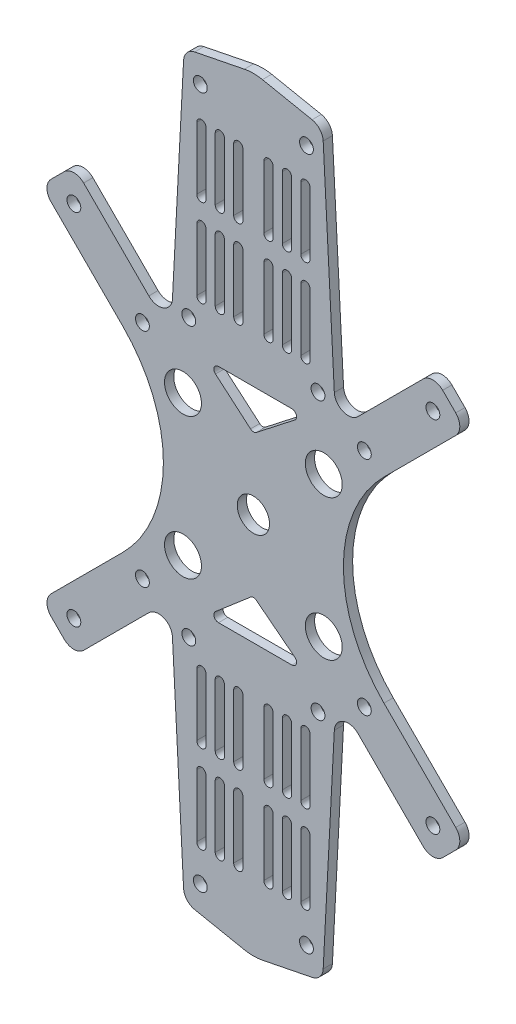
from build123d import *

# Parameters (mm, degrees)
CROQUIS1_R              = 4
CROQUIS1_R_2            = 1.5
CROQUIS1_R_3            = 3.5
SALIENTE_EXTRUIR1_DEPTH = 2
REDONDEO1_R             = 3
REDONDEO2_R             = 10


with BuildPart() as part:
    # Croquis1 → Saliente-Extruir1 (new body)
    with BuildSketch(Plane.XY):
        with BuildLine():
            Line((-42.426406871, 42.426406871), (-38.890872965, 45.961940777))
            Line((-38.890872965, 45.961940777), (-31.096194078, 38.16726189))
            Line((-31.096194078, 38.16726189), (-22.653119822, 29.724187634))
            ThreePointArc((-22.653119822, 29.724187634), (-19.456811617, 29.044722177), (-17.535923889, 31.688251973))
            Line((-17.535923889, 31.688251973), (-15, 80))
            Line((-15, 80), (0, 83))
            Line((0, 83), (15, 80))
            Line((15, 80), (17.535923889, 31.688251973))
            ThreePointArc((17.535923889, 31.688251973), (19.456811617, 29.044722177), (22.653119822, 29.724187634))
            Line((22.653119822, 29.724187634), (31.096194078, 38.16726189))
            Line((31.096194078, 38.16726189), (38.890872965, 45.961940777))
            Line((38.890872965, 45.961940777), (42.426406871, 42.426406871))
            Line((42.426406871, 42.426406871), (45.961940777, 38.890872965))
            Line((45.961940777, 38.890872965), (38.16726189, 31.096194078))
            Line((38.16726189, 31.096194078), (28.284271247, 21.213203436))
            ThreePointArc((28.284271247, 21.213203436), (19.497474683, 0), (28.284271247, -21.213203436))
            Line((28.284271247, -21.213203436), (38.16726189, -31.096194078))
            Line((38.16726189, -31.096194078), (45.961940777, -38.890872965))
            Line((45.961940777, -38.890872965), (42.426406871, -42.426406871))
            Line((42.426406871, -42.426406871), (38.890872965, -45.961940777))
            Line((38.890872965, -45.961940777), (31.096194078, -38.16726189))
            Line((31.096194078, -38.16726189), (22.653119822, -29.724187634))
            ThreePointArc((22.653119822, -29.724187634), (19.456811617, -29.044722177), (17.535923889, -31.688251973))
            Line((17.535923889, -31.688251973), (15, -80))
            Line((15, -80), (0, -83))
            Line((0, -83), (-15, -80))
            Line((-15, -80), (-17.535923889, -31.688251973))
            ThreePointArc((-17.535923889, -31.688251973), (-19.456811617, -29.044722177), (-22.653119822, -29.724187634))
            Line((-22.653119822, -29.724187634), (-31.096194078, -38.16726189))
            Line((-31.096194078, -38.16726189), (-38.890872965, -45.961940777))
            Line((-38.890872965, -45.961940777), (-42.426406871, -42.426406871))
            Line((-42.426406871, -42.426406871), (-45.961940777, -38.890872965))
            Line((-45.961940777, -38.890872965), (-38.16726189, -31.096194078))
            Line((-38.16726189, -31.096194078), (-28.284271247, -21.213203436))
            ThreePointArc((-28.284271247, -21.213203436), (-19.497474683, 0), (-28.284271247, 21.213203436))
            Line((-28.284271247, 21.213203436), (-38.16726189, 31.096194078))
            Line((-38.16726189, 31.096194078), (-45.961940777, 38.890872965))
            Line((-45.961940777, 38.890872965), (-42.426406871, 42.426406871))
        make_face()
        with Locations((-15.25, 15.25)):
            Circle(CROQUIS1_R, mode=Mode.SUBTRACT)
        with Locations((-24.04163056, 24.04163056)):
            Circle(CROQUIS1_R_2, mode=Mode.SUBTRACT)
        with Locations((-38.890872965, 38.890872965)):
            Circle(CROQUIS1_R_2, mode=Mode.SUBTRACT)
        with Locations(Location((38.890872965, 38.890872965, 0), (0, 0, 180))):
            Circle(CROQUIS1_R_2, mode=Mode.SUBTRACT)
        with Locations(Location((24.04163056, 24.04163056, 0), (0, 0, 180))):
            Circle(CROQUIS1_R_2, mode=Mode.SUBTRACT)
        with Locations(Location((15.25, 15.25, 0), (0, 0, 180))):
            Circle(CROQUIS1_R, mode=Mode.SUBTRACT)
        with Locations((15.25, -15.25)):
            Circle(CROQUIS1_R, mode=Mode.SUBTRACT)
        with Locations((24.04163056, -24.04163056)):
            Circle(CROQUIS1_R_2, mode=Mode.SUBTRACT)
        with Locations((38.890872965, -38.890872965)):
            Circle(CROQUIS1_R_2, mode=Mode.SUBTRACT)
        with Locations(Location((-15.25, -15.25, 0), (0, 0, 180))):
            Circle(CROQUIS1_R, mode=Mode.SUBTRACT)
        with Locations(Location((-24.04163056, -24.04163056, 0), (0, 0, 180))):
            Circle(CROQUIS1_R_2, mode=Mode.SUBTRACT)
        with Locations(Location((-38.890872965, -38.890872965, 0), (0, 0, 180))):
            Circle(CROQUIS1_R_2, mode=Mode.SUBTRACT)
        Circle(CROQUIS1_R_3, mode=Mode.SUBTRACT)
        with Locations((-11.5, -75)):
            Circle(CROQUIS1_R_2, mode=Mode.SUBTRACT)
        with Locations(Location((-14, 30, 0), (0, 0, 180))):
            Circle(CROQUIS1_R_2, mode=Mode.SUBTRACT)
        with Locations(Location((11.5, -75, 0), (0, 0, 180))):
            Circle(CROQUIS1_R_2, mode=Mode.SUBTRACT)
        with Locations((11.5, 75)):
            Circle(CROQUIS1_R_2, mode=Mode.SUBTRACT)
        with Locations(Location((-11.5, 75, 0), (0, 0, 180))):
            Circle(CROQUIS1_R_2, mode=Mode.SUBTRACT)
        with Locations((14, 30)):
            Circle(CROQUIS1_R_2, mode=Mode.SUBTRACT)
        with Locations(Location((14, -30, 0), (0, 0, 180))):
            Circle(CROQUIS1_R_2, mode=Mode.SUBTRACT)
        with Locations((-14, -30)):
            Circle(CROQUIS1_R_2, mode=Mode.SUBTRACT)
        with BuildLine():
            Line((-12.267961944, -54), (-12.267961944, -67.5))
            ThreePointArc((-12.267961944, -67.5), (-11.267961944, -68.5), (-10.267961944, -67.5))
            Line((-10.267961944, -67.5), (-10.267961944, -54))
            ThreePointArc((-10.267961944, -54), (-11.267961944, -53), (-12.267961944, -54))
        make_face(mode=Mode.SUBTRACT)
        with BuildLine():
            Line((-8.267961944, -54), (-8.267961944, -67.5))
            ThreePointArc((-8.267961944, -67.5), (-7.267961944, -68.5), (-6.267961944, -67.5))
            Line((-6.267961944, -67.5), (-6.267961944, -54))
            ThreePointArc((-6.267961944, -54), (-7.267961944, -53), (-8.267961944, -54))
        make_face(mode=Mode.SUBTRACT)
        with BuildLine():
            Line((-4.267961944, -54), (-4.267961944, -67.5))
            ThreePointArc((-4.267961944, -67.5), (-3.267961944, -68.5), (-2.267961944, -67.5))
            Line((-2.267961944, -67.5), (-2.267961944, -54))
            ThreePointArc((-2.267961944, -54), (-3.267961944, -53), (-4.267961944, -54))
        make_face(mode=Mode.SUBTRACT)
        with BuildLine():
            Line((-8.267961944, -35), (-8.267961944, -48.5))
            ThreePointArc((-8.267961944, -48.5), (-7.267961944, -49.5), (-6.267961944, -48.5))
            Line((-6.267961944, -48.5), (-6.267961944, -35))
            ThreePointArc((-6.267961944, -35), (-7.267961944, -34), (-8.267961944, -35))
        make_face(mode=Mode.SUBTRACT)
        with BuildLine():
            Line((-4.267961944, -35), (-4.267961944, -48.5))
            ThreePointArc((-4.267961944, -48.5), (-3.267961944, -49.5), (-2.267961944, -48.5))
            Line((-2.267961944, -48.5), (-2.267961944, -35))
            ThreePointArc((-2.267961944, -35), (-3.267961944, -34), (-4.267961944, -35))
        make_face(mode=Mode.SUBTRACT)
        with BuildLine():
            Line((-12.267961944, -35), (-12.267961944, -48.5))
            ThreePointArc((-12.267961944, -48.5), (-11.267961944, -49.5), (-10.267961944, -48.5))
            Line((-10.267961944, -48.5), (-10.267961944, -35))
            ThreePointArc((-10.267961944, -35), (-11.267961944, -34), (-12.267961944, -35))
        make_face(mode=Mode.SUBTRACT)
        with BuildLine():
            Line((10.267961944, -35), (10.267961944, -48.5))
            ThreePointArc((10.267961944, -48.5), (11.267961944, -49.5), (12.267961944, -48.5))
            Line((12.267961944, -48.5), (12.267961944, -35))
            ThreePointArc((12.267961944, -35), (11.267961944, -34), (10.267961944, -35))
        make_face(mode=Mode.SUBTRACT)
        with BuildLine():
            Line((2.267961944, -35), (2.267961944, -48.5))
            ThreePointArc((2.267961944, -48.5), (3.267961944, -49.5), (4.267961944, -48.5))
            Line((4.267961944, -48.5), (4.267961944, -35))
            ThreePointArc((4.267961944, -35), (3.267961944, -34), (2.267961944, -35))
        make_face(mode=Mode.SUBTRACT)
        with BuildLine():
            Line((6.267961944, -35), (6.267961944, -48.5))
            ThreePointArc((6.267961944, -48.5), (7.267961944, -49.5), (8.267961944, -48.5))
            Line((8.267961944, -48.5), (8.267961944, -35))
            ThreePointArc((8.267961944, -35), (7.267961944, -34), (6.267961944, -35))
        make_face(mode=Mode.SUBTRACT)
        with BuildLine():
            Line((2.267961944, -54), (2.267961944, -67.5))
            ThreePointArc((2.267961944, -67.5), (3.267961944, -68.5), (4.267961944, -67.5))
            Line((4.267961944, -67.5), (4.267961944, -54))
            ThreePointArc((4.267961944, -54), (3.267961944, -53), (2.267961944, -54))
        make_face(mode=Mode.SUBTRACT)
        with BuildLine():
            Line((6.267961944, -54), (6.267961944, -67.5))
            ThreePointArc((6.267961944, -67.5), (7.267961944, -68.5), (8.267961944, -67.5))
            Line((8.267961944, -67.5), (8.267961944, -54))
            ThreePointArc((8.267961944, -54), (7.267961944, -53), (6.267961944, -54))
        make_face(mode=Mode.SUBTRACT)
        with BuildLine():
            Line((10.267961944, -54), (10.267961944, -67.5))
            ThreePointArc((10.267961944, -67.5), (11.267961944, -68.5), (12.267961944, -67.5))
            Line((12.267961944, -67.5), (12.267961944, -54))
            ThreePointArc((12.267961944, -54), (11.267961944, -53), (10.267961944, -54))
        make_face(mode=Mode.SUBTRACT)
        with BuildLine():
            Line((12.267961944, 54), (12.267961944, 67.5))
            ThreePointArc((12.267961944, 67.5), (11.267961944, 68.5), (10.267961944, 67.5))
            Line((10.267961944, 67.5), (10.267961944, 54))
            ThreePointArc((10.267961944, 54), (11.267961944, 53), (12.267961944, 54))
        make_face(mode=Mode.SUBTRACT)
        with BuildLine():
            Line((8.267961944, 54), (8.267961944, 67.5))
            ThreePointArc((8.267961944, 67.5), (7.267961944, 68.5), (6.267961944, 67.5))
            Line((6.267961944, 67.5), (6.267961944, 54))
            ThreePointArc((6.267961944, 54), (7.267961944, 53), (8.267961944, 54))
        make_face(mode=Mode.SUBTRACT)
        with BuildLine():
            Line((4.267961944, 54), (4.267961944, 67.5))
            ThreePointArc((4.267961944, 67.5), (3.267961944, 68.5), (2.267961944, 67.5))
            Line((2.267961944, 67.5), (2.267961944, 54))
            ThreePointArc((2.267961944, 54), (3.267961944, 53), (4.267961944, 54))
        make_face(mode=Mode.SUBTRACT)
        with BuildLine():
            Line((8.267961944, 35), (8.267961944, 48.5))
            ThreePointArc((8.267961944, 48.5), (7.267961944, 49.5), (6.267961944, 48.5))
            Line((6.267961944, 48.5), (6.267961944, 35))
            ThreePointArc((6.267961944, 35), (7.267961944, 34), (8.267961944, 35))
        make_face(mode=Mode.SUBTRACT)
        with BuildLine():
            Line((4.267961944, 35), (4.267961944, 48.5))
            ThreePointArc((4.267961944, 48.5), (3.267961944, 49.5), (2.267961944, 48.5))
            Line((2.267961944, 48.5), (2.267961944, 35))
            ThreePointArc((2.267961944, 35), (3.267961944, 34), (4.267961944, 35))
        make_face(mode=Mode.SUBTRACT)
        with BuildLine():
            Line((12.267961944, 35), (12.267961944, 48.5))
            ThreePointArc((12.267961944, 48.5), (11.267961944, 49.5), (10.267961944, 48.5))
            Line((10.267961944, 48.5), (10.267961944, 35))
            ThreePointArc((10.267961944, 35), (11.267961944, 34), (12.267961944, 35))
        make_face(mode=Mode.SUBTRACT)
        with BuildLine():
            Line((-10.267961944, 35), (-10.267961944, 48.5))
            ThreePointArc((-10.267961944, 48.5), (-11.267961944, 49.5), (-12.267961944, 48.5))
            Line((-12.267961944, 48.5), (-12.267961944, 35))
            ThreePointArc((-12.267961944, 35), (-11.267961944, 34), (-10.267961944, 35))
        make_face(mode=Mode.SUBTRACT)
        with BuildLine():
            Line((-2.267961944, 35), (-2.267961944, 48.5))
            ThreePointArc((-2.267961944, 48.5), (-3.267961944, 49.5), (-4.267961944, 48.5))
            Line((-4.267961944, 48.5), (-4.267961944, 35))
            ThreePointArc((-4.267961944, 35), (-3.267961944, 34), (-2.267961944, 35))
        make_face(mode=Mode.SUBTRACT)
        with BuildLine():
            Line((-6.267961944, 35), (-6.267961944, 48.5))
            ThreePointArc((-6.267961944, 48.5), (-7.267961944, 49.5), (-8.267961944, 48.5))
            Line((-8.267961944, 48.5), (-8.267961944, 35))
            ThreePointArc((-8.267961944, 35), (-7.267961944, 34), (-6.267961944, 35))
        make_face(mode=Mode.SUBTRACT)
        with BuildLine():
            Line((-2.267961944, 54), (-2.267961944, 67.5))
            ThreePointArc((-2.267961944, 67.5), (-3.267961944, 68.5), (-4.267961944, 67.5))
            Line((-4.267961944, 67.5), (-4.267961944, 54))
            ThreePointArc((-4.267961944, 54), (-3.267961944, 53), (-2.267961944, 54))
        make_face(mode=Mode.SUBTRACT)
        with BuildLine():
            Line((-6.267961944, 54), (-6.267961944, 67.5))
            ThreePointArc((-6.267961944, 67.5), (-7.267961944, 68.5), (-8.267961944, 67.5))
            Line((-8.267961944, 67.5), (-8.267961944, 54))
            ThreePointArc((-8.267961944, 54), (-7.267961944, 53), (-6.267961944, 54))
        make_face(mode=Mode.SUBTRACT)
        with BuildLine():
            Line((-10.267961944, 54), (-10.267961944, 67.5))
            ThreePointArc((-10.267961944, 67.5), (-11.267961944, 68.5), (-12.267961944, 67.5))
            Line((-12.267961944, 67.5), (-12.267961944, 54))
            ThreePointArc((-12.267961944, 54), (-11.267961944, 53), (-10.267961944, 54))
        make_face(mode=Mode.SUBTRACT)
        with BuildLine():
            Line((-0.620989881, -15.781703725), (-8.212878231, -22.282027547))
            ThreePointArc((-8.212878231, -22.282027547), (-8.50046857, -23.388327104), (-7.562491222, -24.04163056))
            Line((-7.562491222, -24.04163056), (8.360661842, -24.04163056))
            ThreePointArc((8.360661842, -24.04163056), (9.30628687, -23.36688939), (8.975807622, -22.253217173))
            Line((8.975807622, -22.253217173), (0.644542909, -15.75289335))
            ThreePointArc((0.644542909, -15.75289335), (0.006637615, -15.541565769), (-0.620989881, -15.781703725))
        make_face(mode=Mode.SUBTRACT)
        with BuildLine():
            Line((-7.562491222, 24.04163056), (8.360661842, 24.04163056))
            ThreePointArc((8.360661842, 24.04163056), (9.30628687, 23.36688939), (8.975807622, 22.253217173))
            Line((8.975807622, 22.253217173), (0.644542909, 15.75289335))
            ThreePointArc((0.644542909, 15.75289335), (0.006637615, 15.541565769), (-0.620989881, 15.781703725))
            Line((-0.620989881, 15.781703725), (-8.212878231, 22.282027547))
            ThreePointArc((-8.212878231, 22.282027547), (-8.50046857, 23.388327104), (-7.562491222, 24.04163056))
        make_face(mode=Mode.SUBTRACT)
    extrude(amount=SALIENTE_EXTRUIR1_DEPTH)

    # Redondeo1
    redondeo1_edges = [part.edges().sort_by_distance(p)[0] for p in [
        (-38.890872965, 45.961940777, 1),
        (-15, 80, 1),
        (15, 80, 1),
        (38.890872965, 45.961940777, 1),
        (45.961940777, 38.890872965, 1),
        (45.961940777, -38.890872965, 1),
        (38.890872965, -45.961940777, 1),
        (15, -80, 1),
        (-15, -80, 1),
        (-38.890872965, -45.961940777, 1),
        (-45.961940777, -38.890872965, 1),
        (-45.961940777, 38.890872965, 1),
    ]]
    fillet(redondeo1_edges, radius=REDONDEO1_R)

    # Redondeo2
    redondeo2_edges = [part.edges().sort_by_distance(p)[0] for p in [
        (0, 83, 1),
        (0, -83, 1),
    ]]
    fillet(redondeo2_edges, radius=REDONDEO2_R)


solid = part.part
